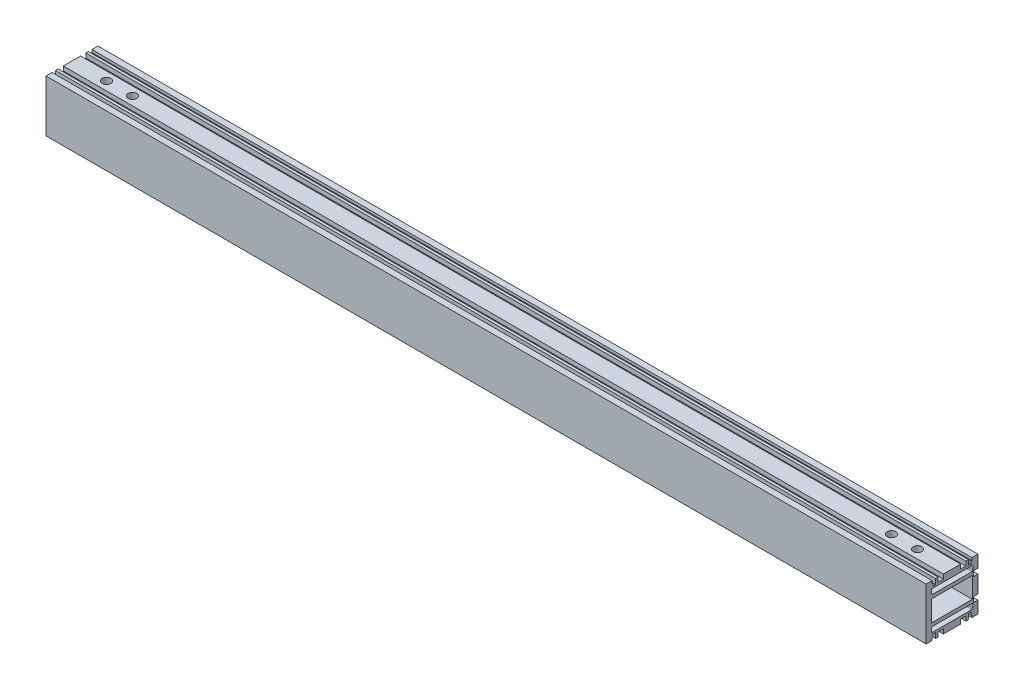
from build123d import *

# Parameters (mm, degrees)
SKETCH_1_W             = 23.5
SKETCH_1_H             = 12
EXTRUDE_1_DEPTH        = 254.5
HOLE_WIZARD_M6_1_D     = 5
HOLE_WIZARD_M6_1_DEPTH = 19
HOLE_WIZARD_M6_1_TIP   = 1.502151548
HOLE_WIZARD_M6_2_D     = 5
HOLE_WIZARD_M6_2_DEPTH = 19
HOLE_WIZARD_M6_2_TIP   = 1.502151548


with BuildPart() as part:
    # 草图1 → 凸台-拉伸1 (new, symmetric)
    with BuildSketch(Plane(origin=(0, 0, 0), x_dir=(0, 0, -1), z_dir=(1, 0, 0))):
        Polygon((-15, 15), (-11.5, 15), (-11.5, 13.5), (-11, 13.5), (-11, 12), (-9.5, 12), (-9.5, 15), (-8, 15), (-8, 12.5), (-5, 12.5), (-5, 15), (5, 15), (5, 12.5), (8, 12.5), (8, 15), (9.5, 15), (9.5, 12), (11, 12), (11, 13.5), (11.5, 13.5), (11.5, 15), (15, 15), (15, 8), (12.5, 8), (12.5, 5), (15, 5), (15, -5), (12.5, -5), (12.5, -8), (15, -8), (15, -15), (11.5, -15), (11.5, -13.5), (11, -13.5), (11, -12), (9.5, -12), (9.5, -15), (8, -15), (8, -12.5), (5, -12.5), (5, -15), (-5, -15), (-5, -12.5), (-8, -12.5), (-8, -15), (-9.5, -15), (-9.5, -12), (-11, -12), (-11, -13.5), (-11.5, -13.5), (-11.5, -15), (-15, -15), align=None)
        with BuildLine():
            Line((12, -10.5), (12, -8.5))
            ThreePointArc((12, -8.5), (11.853553391, -8.146446609), (11.5, -8))
            Line((11.5, -8), (-11.5, -8))
            ThreePointArc((-11.5, -8), (-11.853553391, -8.146446609), (-12, -8.5))
            Line((-12, -8.5), (-12, -10.5))
            ThreePointArc((-12, -10.5), (-11.853553391, -10.853553391), (-11.5, -11))
            Line((-11.5, -11), (11.5, -11))
            ThreePointArc((11.5, -11), (11.853553391, -10.853553391), (12, -10.5))
        make_face(mode=Mode.SUBTRACT)
        with BuildLine():
            Line((-11.5, 11), (11.5, 11))
            ThreePointArc((11.5, 11), (11.853553391, 10.853553391), (12, 10.5))
            Line((12, 10.5), (12, 8.5))
            ThreePointArc((12, 8.5), (11.853553391, 8.146446609), (11.5, 8))
            Line((11.5, 8), (-11.5, 8))
            ThreePointArc((-11.5, 8), (-11.853553391, 8.146446609), (-12, 8.5))
            Line((-12, 8.5), (-12, 10.5))
            ThreePointArc((-12, 10.5), (-11.853553391, 10.853553391), (-11.5, 11))
        make_face(mode=Mode.SUBTRACT)
        Rectangle(SKETCH_1_W, SKETCH_1_H, mode=Mode.SUBTRACT)
    extrude(amount=EXTRUDE_1_DEPTH, both=True)

    # M6 螺纹孔1
    with Locations(Plane(origin=(0, 0, -15), x_dir=(-1, 0, 0), z_dir=(0, 0, -1))):
        with Locations((-234.5, 0), (-219.5, 0), (1.5, 0), (16.5, 0)):
            Hole(HOLE_WIZARD_M6_1_D / 2, depth=HOLE_WIZARD_M6_1_DEPTH)
            with Locations((0, 0, -(HOLE_WIZARD_M6_1_DEPTH + HOLE_WIZARD_M6_1_TIP / 2))):  # 118° drill point
                Cone(0, HOLE_WIZARD_M6_1_D / 2, HOLE_WIZARD_M6_1_TIP, mode=Mode.SUBTRACT)

    # M6 螺纹孔2
    with Locations(Plane(origin=(0, 15, 0), x_dir=(1, 0, 0), z_dir=(0, 1, 0))):
        with Locations((234.5, 0), (219.5, 0), (-219.5, 0), (-234.5, 0)):
            Hole(HOLE_WIZARD_M6_2_D / 2, depth=HOLE_WIZARD_M6_2_DEPTH)
            with Locations((0, 0, -(HOLE_WIZARD_M6_2_DEPTH + HOLE_WIZARD_M6_2_TIP / 2))):  # 118° drill point
                Cone(0, HOLE_WIZARD_M6_2_D / 2, HOLE_WIZARD_M6_2_TIP, mode=Mode.SUBTRACT)


solid = part.part
